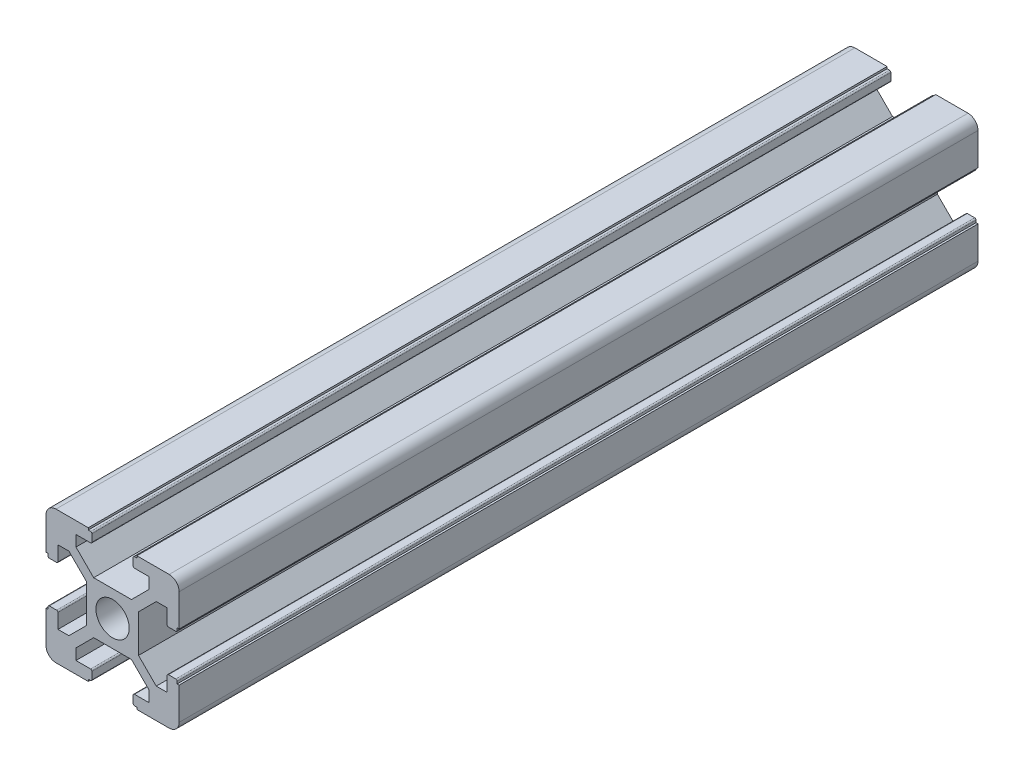
from build123d import *

# Parameters (mm, degrees)
SKETCH_1_R      = 2.5
EXTRUDE_2_DEPTH = 120
EXTRUDE_3_DEPTH = 120


with BuildPart() as part:
    # 草图1 → 凸台-拉伸2 (new body)
    with BuildSketch(Plane.XY):
        with BuildLine():
            Line((3.65, 10), (8.5, 10))
            ThreePointArc((8.5, 10), (9.560660172, 9.560660172), (10, 8.5))
            Line((10, 8.5), (10, 3.65))
            Line((10, 3.65), (8.2, 3.65))
            Line((8.2, 3.65), (8.2, 5.5))
            Line((8.2, 5.5), (6.560660172, 5.5))
            Line((6.560660172, 5.5), (3.9, 2.839339828))
            Line((3.9, 2.839339828), (3.9, -2.839339828))
            Line((3.9, -2.839339828), (6.560660172, -5.5))
            Line((6.560660172, -5.5), (8.2, -5.5))
            Line((8.2, -5.5), (8.2, -3.65))
            Line((8.2, -3.65), (10, -3.65))
            Line((10, -3.65), (10, -8.5))
            ThreePointArc((10, -8.5), (9.560660172, -9.560660172), (8.5, -10))
            Line((8.5, -10), (3.65, -10))
            Line((3.65, -10), (3.65, -8.2))
            Line((3.65, -8.2), (5.5, -8.2))
            Line((5.5, -8.2), (5.5, -6.560660172))
            Line((5.5, -6.560660172), (2.839339828, -3.9))
            Line((2.839339828, -3.9), (-2.839339828, -3.9))
            Line((-2.839339828, -3.9), (-5.5, -6.560660172))
            Line((-5.5, -6.560660172), (-5.5, -8.2))
            Line((-5.5, -8.2), (-3.65, -8.2))
            Line((-3.65, -8.2), (-3.65, -10))
            Line((-3.65, -10), (-8.5, -10))
            ThreePointArc((-8.5, -10), (-9.560660172, -9.560660172), (-10, -8.5))
            Line((-10, -8.5), (-10, -3.65))
            Line((-10, -3.65), (-8.2, -3.65))
            Line((-8.2, -3.65), (-8.2, -5.5))
            Line((-8.2, -5.5), (-6.560660172, -5.5))
            Line((-6.560660172, -5.5), (-3.9, -2.839339828))
            Line((-3.9, -2.839339828), (-3.9, 2.839339828))
            Line((-3.9, 2.839339828), (-6.560660172, 5.5))
            Line((-6.560660172, 5.5), (-8.2, 5.5))
            Line((-8.2, 5.5), (-8.2, 3.65))
            Line((-8.2, 3.65), (-10, 3.65))
            Line((-10, 3.65), (-10, 8.5))
            ThreePointArc((-10, 8.5), (-9.560660172, 9.560660172), (-8.5, 10))
            Line((-8.5, 10), (-3.65, 10))
            Line((-3.65, 10), (-3.65, 8.2))
            Line((-3.65, 8.2), (-5.5, 8.2))
            Line((-5.5, 8.2), (-5.5, 6.560660172))
            Line((-5.5, 6.560660172), (-2.839339828, 3.9))
            Line((-2.839339828, 3.9), (2.839339828, 3.9))
            Line((2.839339828, 3.9), (5.5, 6.560660172))
            Line((5.5, 6.560660172), (5.5, 8.2))
            Line((5.5, 8.2), (3.65, 8.2))
            Line((3.65, 8.2), (3.65, 10))
        make_face()
        Circle(SKETCH_1_R, mode=Mode.SUBTRACT)
    extrude(amount=EXTRUDE_2_DEPTH)

    # 草图3 → 凸台-拉伸3 (add)
    with BuildSketch(Plane.XY.offset(120)):
        with BuildLine():
            Line((-8.2, 3.65), (-9.7, 3.65))
            Line((-9.7, 3.65), (-9.7, 3.3))
            ThreePointArc((-9.7, 3.3), (-9.641421356, 3.158578644), (-9.5, 3.1))
            Line((-9.5, 3.1), (-8.4, 3.1))
            ThreePointArc((-8.4, 3.1), (-8.258578644, 3.158578644), (-8.2, 3.3))
            Line((-8.2, 3.3), (-8.2, 3.65))
        make_face()
        with BuildLine():
            Line((-3.65, 9.7), (-3.65, 8.2))
            Line((-3.65, 8.2), (-3.3, 8.2))
            ThreePointArc((-3.3, 8.2), (-3.158578644, 8.258578644), (-3.1, 8.4))
            Line((-3.1, 8.4), (-3.1, 9.5))
            ThreePointArc((-3.1, 9.5), (-3.158578644, 9.641421356), (-3.3, 9.7))
            Line((-3.3, 9.7), (-3.65, 9.7))
        make_face()
        with BuildLine():
            Line((3.65, 8.2), (3.65, 9.7))
            Line((3.65, 9.7), (3.3, 9.7))
            ThreePointArc((3.3, 9.7), (3.158578644, 9.641421356), (3.1, 9.5))
            Line((3.1, 9.5), (3.1, 8.4))
            ThreePointArc((3.1, 8.4), (3.158578644, 8.258578644), (3.3, 8.2))
            Line((3.3, 8.2), (3.65, 8.2))
        make_face()
        with BuildLine():
            Line((9.7, 3.65), (8.2, 3.65))
            Line((8.2, 3.65), (8.2, 3.3))
            ThreePointArc((8.2, 3.3), (8.258578644, 3.158578644), (8.4, 3.1))
            Line((8.4, 3.1), (9.5, 3.1))
            ThreePointArc((9.5, 3.1), (9.641421356, 3.158578644), (9.7, 3.3))
            Line((9.7, 3.3), (9.7, 3.65))
        make_face()
        with BuildLine():
            Line((3.65, -9.7), (3.65, -8.2))
            Line((3.65, -8.2), (3.3, -8.2))
            ThreePointArc((3.3, -8.2), (3.158578644, -8.258578644), (3.1, -8.4))
            Line((3.1, -8.4), (3.1, -9.5))
            ThreePointArc((3.1, -9.5), (3.158578644, -9.641421356), (3.3, -9.7))
            Line((3.3, -9.7), (3.65, -9.7))
        make_face()
        with BuildLine():
            Line((-3.65, -8.2), (-3.65, -9.7))
            Line((-3.65, -9.7), (-3.3, -9.7))
            ThreePointArc((-3.3, -9.7), (-3.158578644, -9.641421356), (-3.1, -9.5))
            Line((-3.1, -9.5), (-3.1, -8.4))
            ThreePointArc((-3.1, -8.4), (-3.158578644, -8.258578644), (-3.3, -8.2))
            Line((-3.3, -8.2), (-3.65, -8.2))
        make_face()
        with BuildLine():
            Line((8.2, -3.65), (8.2, -3.3))
            ThreePointArc((8.2, -3.3), (8.258578644, -3.158578644), (8.4, -3.1))
            Line((8.4, -3.1), (9.5, -3.1))
            ThreePointArc((9.5, -3.1), (9.641421356, -3.158578644), (9.7, -3.3))
            Line((9.7, -3.3), (9.7, -3.65))
            Line((9.7, -3.65), (8.2, -3.65))
        make_face()
        with BuildLine():
            Line((-8.2, -3.65), (-8.2, -3.3))
            ThreePointArc((-8.2, -3.3), (-8.258578644, -3.158578644), (-8.4, -3.1))
            Line((-8.4, -3.1), (-9.5, -3.1))
            ThreePointArc((-9.5, -3.1), (-9.641421356, -3.158578644), (-9.7, -3.3))
            Line((-9.7, -3.3), (-9.7, -3.65))
            Line((-9.7, -3.65), (-8.2, -3.65))
        make_face()
    extrude(amount=-EXTRUDE_3_DEPTH)


solid = part.part
